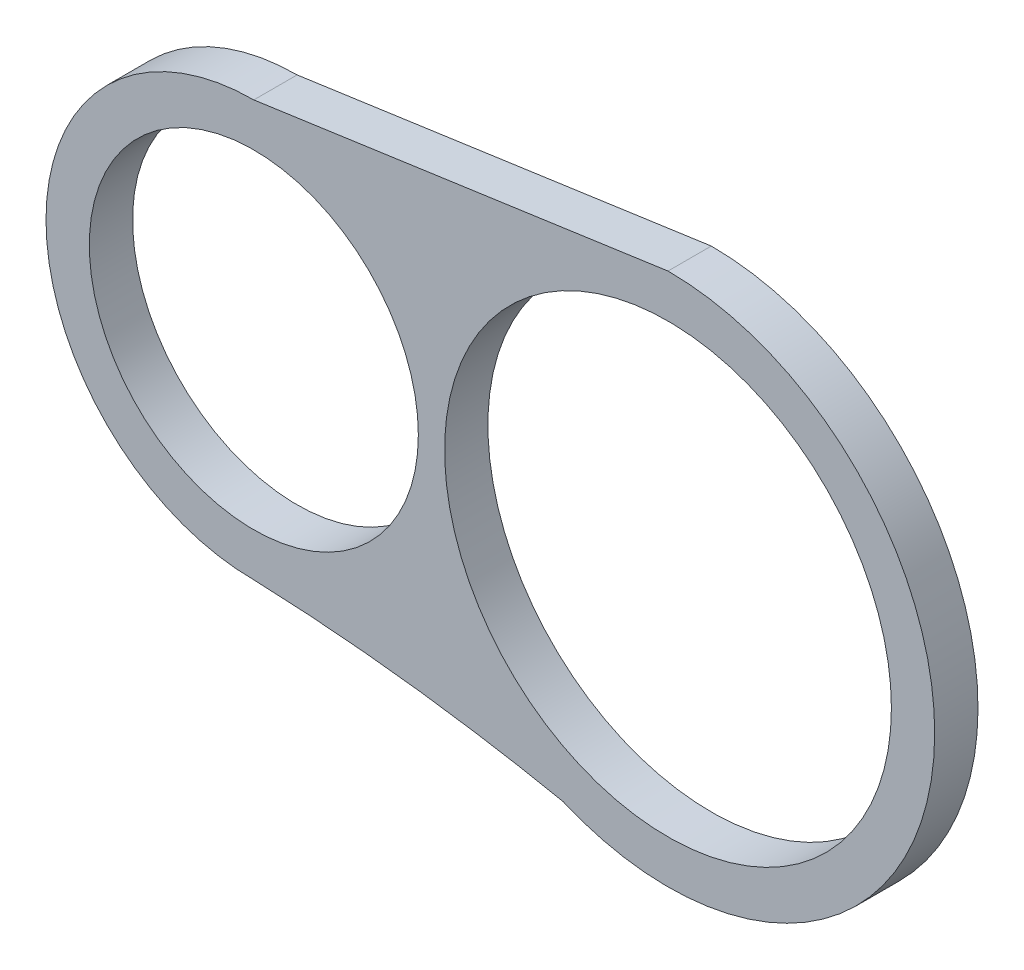
from build123d import *

# Parameters (mm, degrees)
ESBO_O1_R                = 25.8
ESBO_O1_R_2              = 19
RESSALTO_EXTRUS_O1_DEPTH = 5


with BuildPart() as part:
    # Esboço1 → Ressalto-extrusão1 (new body)
    with BuildSketch(Plane.XY):
        with BuildLine():
            ThreePointArc((-23.915, 24), (-47.915, 0), (-23.915, -24))
            add(Edge.make_bspline(
                [(-23.915, -24), (-6.056429517, -24.659084063), (11.802140965, -28.318168126)],
                knots=[0, 0, 0, 0.74675185, 0.74675185, 0.74675185], degree=2))
            ThreePointArc((11.802140965, -28.318168126), (54.088163393, -6.18224966), (23.915, 30.8))
            Line((23.915, 30.8), (-23.915, 24))
        make_face()
        with Locations((23.915, 0)):
            Circle(ESBO_O1_R, mode=Mode.SUBTRACT)
        with Locations((-23.915, 0)):
            Circle(ESBO_O1_R_2, mode=Mode.SUBTRACT)
    extrude(amount=RESSALTO_EXTRUS_O1_DEPTH)


solid = part.part
